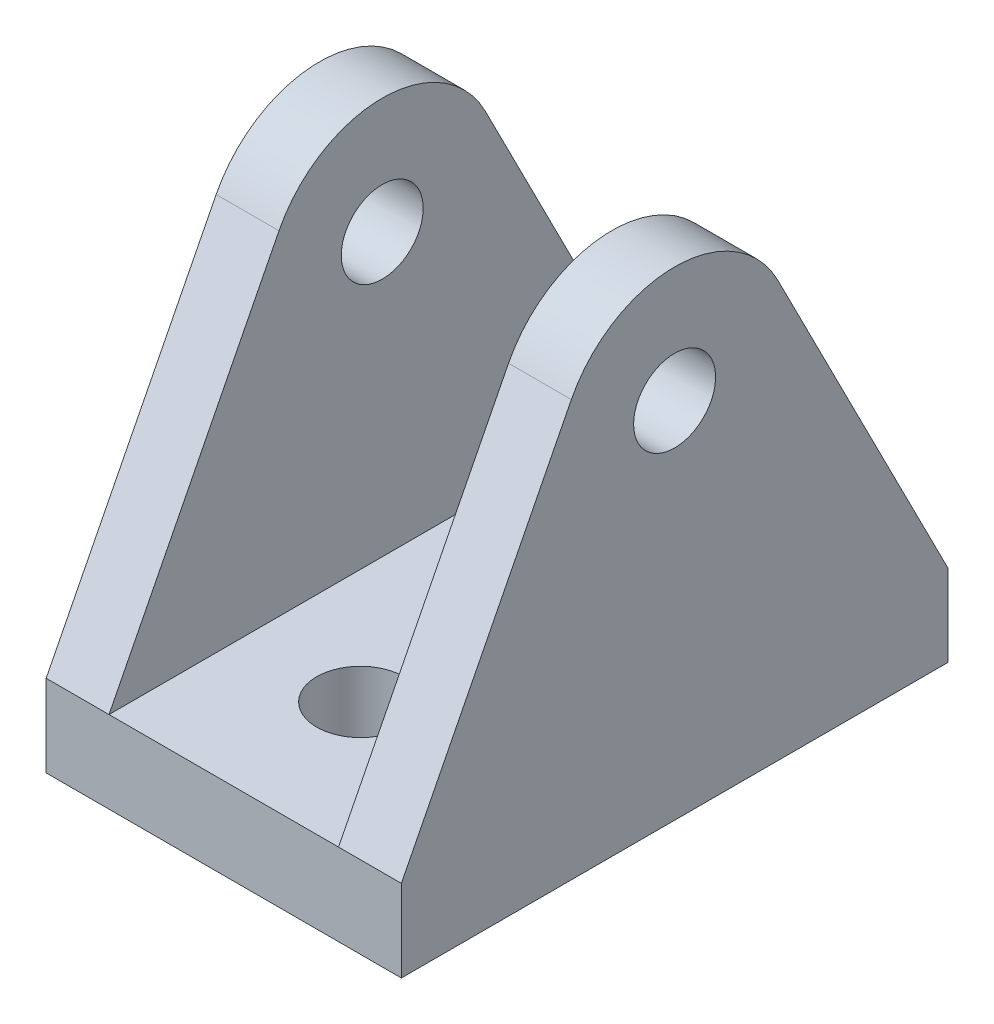
from build123d import *

# Parameters (mm, degrees)
SKETCH_1_W          = 13
SKETCH_1_H          = 20
SKETCH_1_R          = 1.6
EXTRUDE_1_DEPTH     = 3
SKETCH_2_R          = 1.5
EXTRUDE_2_DEPTH     = 13
SKETCH_3_W          = 8.4
SKETCH_3_H          = 14.54
CUT_EXTRUDE_1_DEPTH = 28.384331286


with BuildPart() as part:
    # 草图1 → 凸台-拉伸1 (new body)
    with BuildSketch(Plane(origin=(0, 0, 0), x_dir=(1, 0, 0), z_dir=(0, 1, 0))):
        Rectangle(SKETCH_1_W, SKETCH_1_H)
        with Locations(Location((0, 5, 0), (0, 0, 270))):
            Circle(SKETCH_1_R, mode=Mode.SUBTRACT)
        with Locations(Location((0, -5, 0), (0, 0, 90))):
            Circle(SKETCH_1_R, mode=Mode.SUBTRACT)
    extrude(amount=EXTRUDE_1_DEPTH)

    # 草图2 → 凸台-拉伸2 (add)
    with BuildSketch(Plane.ZY.offset(6.5)):
        with BuildLine():
            Line((-10, 3), (10, 3))
            Line((10, 3), (3.778714502, 15.223256798))
            ThreePointArc((3.778714502, 15.223256798), (0, 17.54), (-3.778714502, 15.223256798))
            Line((-3.778714502, 15.223256798), (-10, 3))
        make_face()
        with Locations((0, 13.3)):
            Circle(SKETCH_2_R, mode=Mode.SUBTRACT)
    extrude(amount=-EXTRUDE_2_DEPTH)

    # 草图3 → 切除-拉伸1 (cut, through all)
    with BuildSketch(Plane(origin=(0, 0, -10), x_dir=(-1, 0, 0), z_dir=(0, 0, -1))):
        with Locations((0, 10.27)):
            Rectangle(SKETCH_3_W, SKETCH_3_H)
    extrude(amount=-CUT_EXTRUDE_1_DEPTH, mode=Mode.SUBTRACT)


solid = part.part
